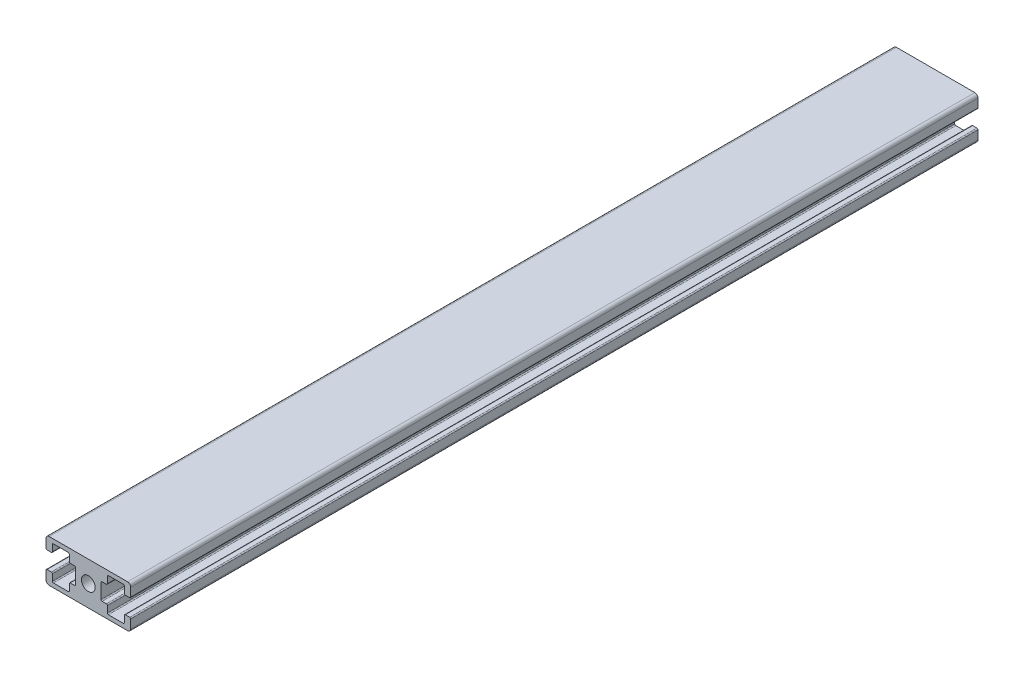
from build123d import *

# Parameters (mm, degrees)
SKETCH1_R           = 3.25
BOSS_EXTRUDE1_DEPTH = 200


with BuildPart() as part:
    # Sketch1 → Boss-Extrude1 (new, symmetric)
    with BuildSketch(Plane.XY):
        with BuildLine():
            Line((1.5, 0), (38.5, 0))
            ThreePointArc((38.5, 0), (39.560660172, 0.439339828), (40, 1.5))
            Line((40, 1.5), (40, 5.5))
            ThreePointArc((40, 5.5), (39.853553391, 5.853553391), (39.5, 6))
            Line((39.5, 6), (37.5, 6))
            ThreePointArc((37.5, 6), (37.146446609, 5.853553391), (37, 5.5))
            Line((37, 5.5), (37, 2.5))
            ThreePointArc((37, 2.5), (36.853553391, 2.146446609), (36.5, 2))
            Line((36.5, 2), (29.5, 2))
            ThreePointArc((29.5, 2), (29.146446609, 2.146446609), (29, 2.5))
            Line((29, 2.5), (29, 5.5))
            ThreePointArc((29, 5.5), (28.853553391, 5.853553391), (28.5, 6))
            Line((28.5, 6), (26.5, 6))
            ThreePointArc((26.5, 6), (26.146446609, 6.146446609), (26, 6.5))
            Line((26, 6.5), (26, 13.5))
            ThreePointArc((26, 13.5), (26.146446609, 13.853553391), (26.5, 14))
            Line((26.5, 14), (28.5, 14))
            ThreePointArc((28.5, 14), (28.853553391, 14.146446609), (29, 14.5))
            Line((29, 14.5), (29, 17.5))
            ThreePointArc((29, 17.5), (29.146446609, 17.853553391), (29.5, 18))
            Line((29.5, 18), (36.5, 18))
            ThreePointArc((36.5, 18), (36.853553391, 17.853553391), (37, 17.5))
            Line((37, 17.5), (37, 14.5))
            ThreePointArc((37, 14.5), (37.146446609, 14.146446609), (37.5, 14))
            Line((37.5, 14), (39.5, 14))
            ThreePointArc((39.5, 14), (39.853553391, 14.146446609), (40, 14.5))
            Line((40, 14.5), (40, 18.5))
            ThreePointArc((40, 18.5), (39.560660172, 19.560660172), (38.5, 20))
            Line((38.5, 20), (1.5, 20))
            ThreePointArc((1.5, 20), (0.439339828, 19.560660172), (0, 18.5))
            Line((0, 18.5), (0, 14.5))
            ThreePointArc((0, 14.5), (0.146446609, 14.146446609), (0.5, 14))
            Line((0.5, 14), (2.5, 14))
            ThreePointArc((2.5, 14), (2.853553391, 14.146446609), (3, 14.5))
            Line((3, 14.5), (3, 17.5))
            ThreePointArc((3, 17.5), (3.146446609, 17.853553391), (3.5, 18))
            Line((3.5, 18), (10.5, 18))
            ThreePointArc((10.5, 18), (10.853553391, 17.853553391), (11, 17.5))
            Line((11, 17.5), (11, 14.5))
            ThreePointArc((11, 14.5), (11.146446609, 14.146446609), (11.5, 14))
            Line((11.5, 14), (13.5, 14))
            ThreePointArc((13.5, 14), (13.853553391, 13.853553391), (14, 13.5))
            Line((14, 13.5), (14, 6.5))
            ThreePointArc((14, 6.5), (13.853553391, 6.146446609), (13.5, 6))
            Line((13.5, 6), (11.5, 6))
            ThreePointArc((11.5, 6), (11.146446609, 5.853553391), (11, 5.5))
            Line((11, 5.5), (11, 2.5))
            ThreePointArc((11, 2.5), (10.853553391, 2.146446609), (10.5, 2))
            Line((10.5, 2), (3.5, 2))
            ThreePointArc((3.5, 2), (3.146446609, 2.146446609), (3, 2.5))
            Line((3, 2.5), (3, 5.5))
            ThreePointArc((3, 5.5), (2.853553391, 5.853553391), (2.5, 6))
            Line((2.5, 6), (0.5, 6))
            ThreePointArc((0.5, 6), (0.146446609, 5.853553391), (0, 5.5))
            Line((0, 5.5), (0, 1.5))
            ThreePointArc((0, 1.5), (0.439339828, 0.439339828), (1.5, 0))
        make_face()
        with Locations((20, 10)):
            Circle(SKETCH1_R, mode=Mode.SUBTRACT)
    extrude(amount=BOSS_EXTRUDE1_DEPTH, both=True)


solid = part.part
